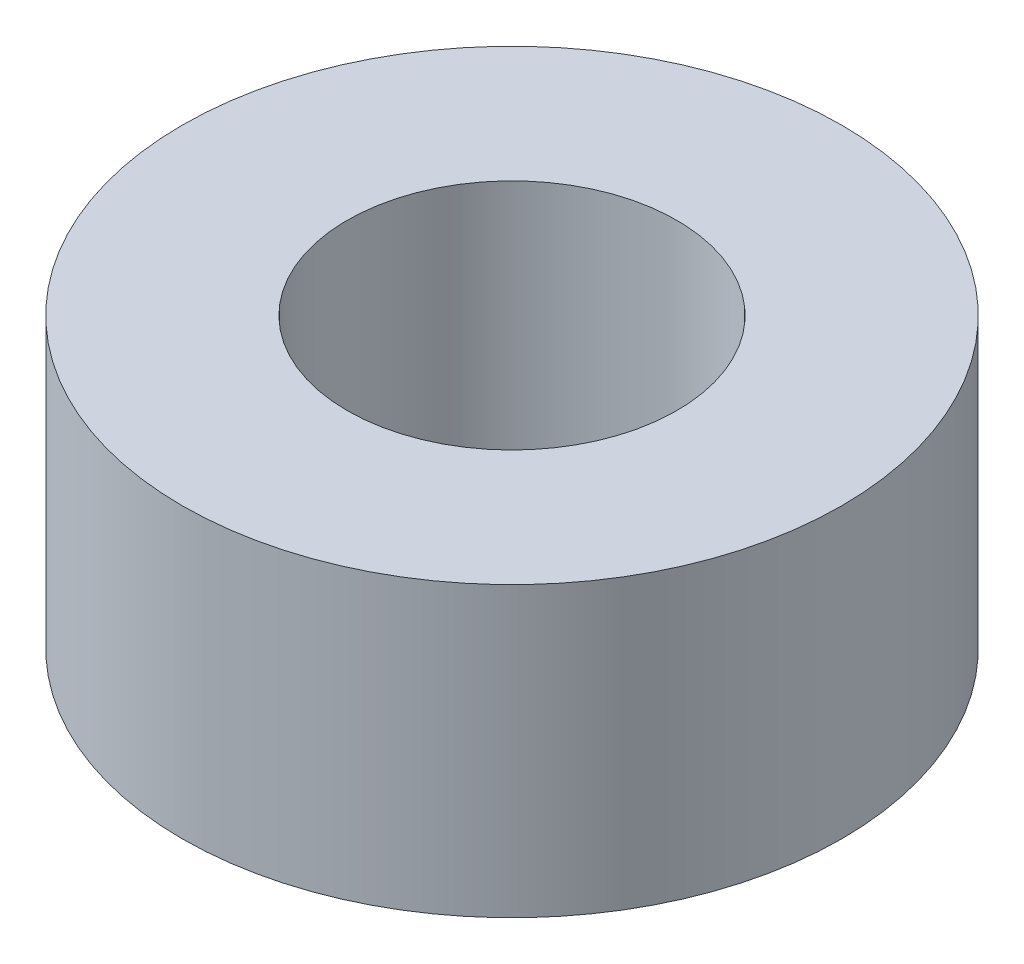
from build123d import *

# Parameters (mm, degrees)
SKETCH_1_R      = 4
SKETCH_1_R_2    = 2
EXTRUDE_1_DEPTH = 3.5


with BuildPart() as part:
    # 草图1 → 凸台-拉伸1 (new body)
    with BuildSketch(Plane(origin=(0, 0, 0), x_dir=(1, 0, 0), z_dir=(0, 1, 0))):
        with Locations(Location((0, 0, 0), (0, 0, 270))):
            Circle(SKETCH_1_R)
        with Locations(Location((0, 0, 0), (0, 0, 270))):
            Circle(SKETCH_1_R_2, mode=Mode.SUBTRACT)
    extrude(amount=EXTRUDE_1_DEPTH)


solid = part.part
